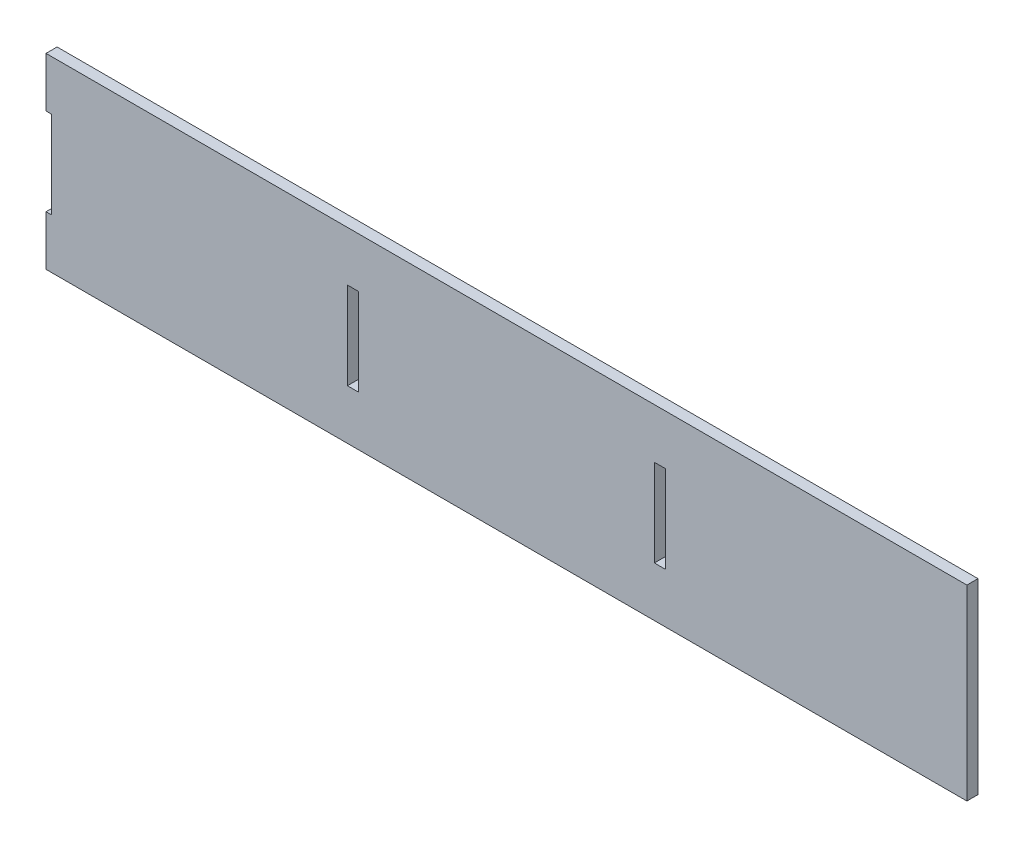
from build123d import *

# Parameters (mm, degrees)
SKETCH1_W           = 3.175
SKETCH1_H           = 53.530097244
BOSS_EXTRUDE1_DEPTH = 263.525
SKETCH5_W           = 3.175
SKETCH5_H           = 24.955097244
CUT_EXTRUDE1_DEPTH  = 266.094755278
LPATTERN1_COUNT     = 4
LPATTERN1_PITCH     = 87.841666667


with BuildPart() as part:
    # Sketch1 → Boss-Extrude1 (new body)
    with BuildSketch(Plane(origin=(0, 0, 0), x_dir=(0, 0, -1), z_dir=(1, 0, 0))):
        with Locations((614.508553399, -1.865756921)):
            Rectangle(SKETCH1_W, SKETCH1_H)
    extrude(amount=BOSS_EXTRUDE1_DEPTH)

    # Sketch5 → Cut-Extrude1 (cut, symmetric)
    with BuildSketch(Plane.XY.offset(-612.921053399)):
        with Locations((0, -1.865756921)):
            Rectangle(SKETCH5_W, SKETCH5_H)
    cut_extrude1 = extrude(amount=CUT_EXTRUDE1_DEPTH, both=True, mode=Mode.SUBTRACT)

    # LPattern1: Cut-Extrude1 ×4, 1 skipped
    with Locations(*[(i * LPATTERN1_PITCH, 0, 0) for i in range(1, LPATTERN1_COUNT) if i not in (3,)]):
        add(cut_extrude1, mode=Mode.SUBTRACT)


solid = part.part
